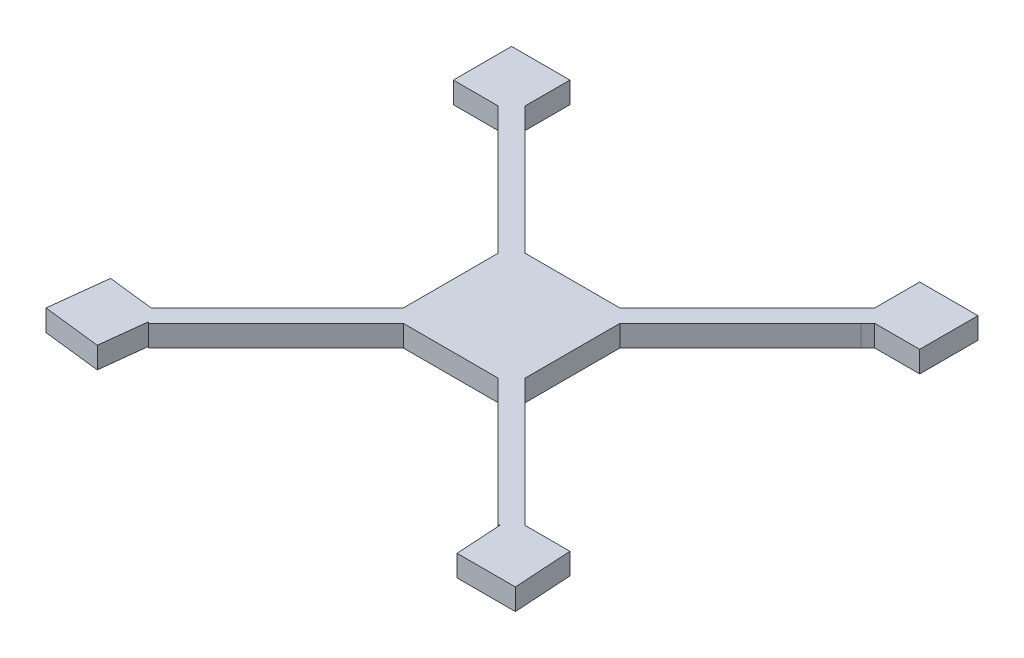
from build123d import *

# Parameters (mm, degrees)
BOSS_EXTRUDE1_DEPTH = 12.7
BOSS_EXTRUDE6_DEPTH = 12.7
CUT_EXTRUDE1_DEPTH  = 10


with BuildPart() as part:
    # Sketch1 → Boss-Extrude1 (new body)
    with BuildSketch(Plane(origin=(0, 0, 0), x_dir=(1, 0, 0), z_dir=(0, 1, 0))):
        Polygon((0, 0), (-71.842048969, 71.842048969), (-63.880459669, 79.803638268), (7.961589299, 7.961589299), (64.406033744, 7.961589299), (136.248082712, 79.803638268), (144.209672011, 71.842048969), (72.367623043, 0), (72.367623043, -56.444444444), (144.209672011, -128.286493413), (136.248082712, -136.248082712), (64.406033744, -64.406033744), (7.961589299, -64.406033744), (-63.880459669, -136.248082712), (-71.842048969, -128.286493413), (0, -56.444444444), align=None)
    extrude(amount=BOSS_EXTRUDE1_DEPTH)

    # Sketch4 → Boss-Extrude6 (add)
    with BuildSketch(Plane(origin=(0, 12.7, 0), x_dir=(1, 0, 0), z_dir=(0, 1, 0))):
        Polygon((-67.861254319, 110.511019008), (-102.549429709, 110.511019008), (-102.549429709, 75.822843618), (-75.822843618, 75.822843618), (-67.904353545, 83.741333692), (-67.861254319, 83.698234466), align=None)
        Polygon((-63.923558895, 79.760539042), (-67.861254319, 83.698234466), (-67.861254319, 75.822843618), align=None)
        Polygon((-67.861254319, 75.822843618), (-67.861254319, 83.698234466), (-67.904353545, 83.741333692), (-75.822843618, 75.822843618), align=None)
        Polygon((-67.861254319, 75.822843618), (-75.822843618, 75.822843618), (-71.842048969, 71.842048969), align=None)
        Polygon((148.06163561, 75.822843618), (140.228877362, 75.822843618), (140.228877362, 83.741333692), (136.248082712, 79.803638268), (144.168507311, 71.79652231), (148.14930196, 75.734217734), align=None)
        Polygon((140.228877362, 83.741333692), (140.228877362, 75.822843618), (148.06163561, 75.822843618), align=None)
        Polygon((140.228877362, 110.511019008), (140.228877362, 83.741333692), (148.06163561, 75.822843618), (174.917052842, 75.822843618), (174.917052842, 110.511019008), align=None)
        Polygon((144.209672011, -128.286493413), (140.228877362, -132.267288063), (147.887031193, -132.267288063), (148.038748927, -132.115570329), align=None)
        Polygon((147.887031193, -132.267288063), (140.228877362, -132.267288063), (140.680194952, -139.474124303), align=None)
        Polygon((140.680194952, -139.474124303), (140.228877362, -132.267288063), (136.248082712, -136.248082712), (140.077159628, -140.077159628), align=None)
        Polygon((174.917052842, -132.267288063), (147.887031193, -132.267288063), (140.680194952, -139.474124303), (142.396926606, -166.887644511), (177.085102086, -166.887644511), align=None)
        Polygon((-63.880459669, -136.248082712), (-67.861254319, -132.267288063), (-68.687385193, -139.452020723), (-67.885891437, -140.25351448), align=None)
        Polygon((-68.687385193, -139.452020723), (-67.861254319, -132.267288063), (-75.001794215, -131.446238659), (-75.847480736, -132.29192518), align=None)
        Polygon((-75.001794215, -131.446238659), (-67.861254319, -132.267288063), (-71.842048969, -128.286493413), align=None)
        Polygon((-71.823738367, -166.728400034), (-68.687385193, -139.452020723), (-75.847480736, -132.29192518), (-75.001794215, -131.446238659), (-102.32236629, -128.304804015), (-106.284850338, -162.765915986), align=None)
    extrude(amount=-BOSS_EXTRUDE6_DEPTH)

    # Sketch10 → Cut-Extrude1 (cut)
    with BuildSketch(Plane(origin=(0, 0, 0), x_dir=(-1, 0, 0), z_dir=(0, -1, 0))):
        with BuildLine():
            ThreePointArc((77.08647461, 91.590101085), (80.856009684, 98.904678295), (88.835255683, 100.915665051))
            Line((88.835255683, 100.915665051), (97.059630047, 90.554214075))
            ThreePointArc((97.059630047, 90.554214075), (93.290094973, 83.239636865), (85.310848974, 81.228650109))
            Line((85.310848974, 81.228650109), (77.08647461, 91.590101085))
        make_face()
        with BuildLine():
            Line((-169.42725309, 90.554214075), (-161.202878726, 100.915665051))
            ThreePointArc((-161.202878726, 100.915665051), (-153.223632727, 98.904678295), (-149.454097653, 91.590101085))
            Line((-149.454097653, 91.590101085), (-157.678472017, 81.228650109))
            ThreePointArc((-157.678472017, 81.228650109), (-165.657718016, 83.239636865), (-169.42725309, 90.554214075))
        make_face()
        with BuildLine():
            ThreePointArc((-149.454097653, -148.034545529), (-153.223632727, -155.34912274), (-161.202878726, -157.360109496))
            Line((-161.202878726, -157.360109496), (-169.42725309, -146.99865852))
            ThreePointArc((-169.42725309, -146.99865852), (-165.657718016, -139.684081309), (-157.678472017, -137.673094553))
            Line((-157.678472017, -137.673094553), (-149.454097653, -148.034545529))
        make_face()
        with BuildLine():
            ThreePointArc((77.08647461, -148.034545529), (80.856009684, -155.34912274), (88.835255683, -157.360109496))
            Line((88.835255683, -157.360109496), (97.059630047, -146.99865852))
            ThreePointArc((97.059630047, -146.99865852), (93.290094973, -139.684081309), (85.310848974, -137.673094553))
            Line((85.310848974, -137.673094553), (77.08647461, -148.034545529))
        make_face()
    extrude(amount=-CUT_EXTRUDE1_DEPTH, mode=Mode.SUBTRACT)


solid = part.part
